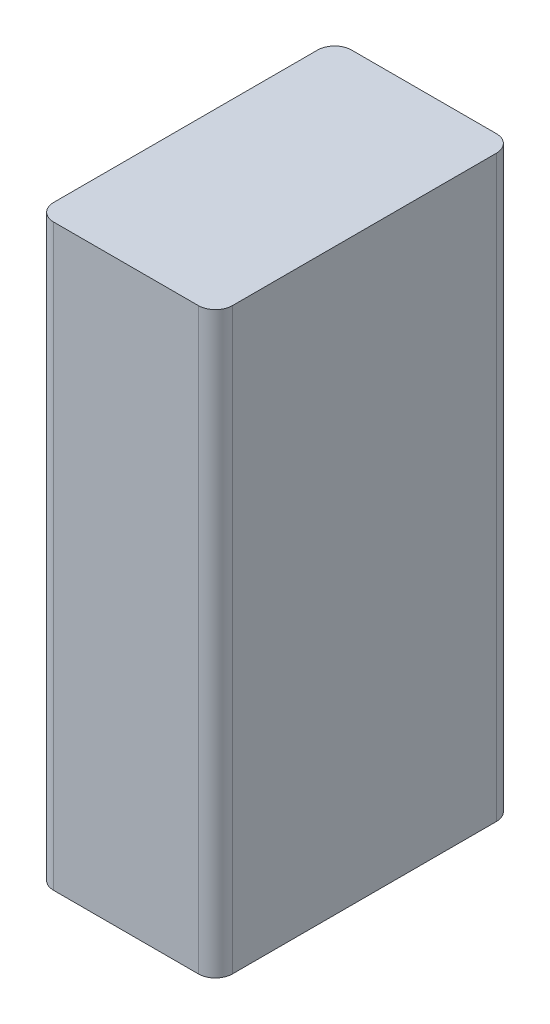
from build123d import *

# Parameters (mm, degrees)
SKETCH1_W           = 21
SKETCH1_H           = 35
BOSS_EXTRUDE1_DEPTH = 68
FILLET1_R           = 2


with BuildPart() as part:
    # Sketch1 → Boss-Extrude1 (new body)
    with BuildSketch(Plane(origin=(0, 0, 0), x_dir=(1, 0, 0), z_dir=(0, 1, 0))):
        with Locations((10.5, 17.5)):
            Rectangle(SKETCH1_W, SKETCH1_H)
    extrude(amount=BOSS_EXTRUDE1_DEPTH)

    # Fillet1
    fillet1_edges = [part.edges().sort_by_distance(p)[0] for p in [
        (0, 34, -35),
        (21, 34, -35),
        (21, 34, 0),
        (0, 34, 0),
    ]]
    fillet(fillet1_edges, radius=FILLET1_R)


solid = part.part
